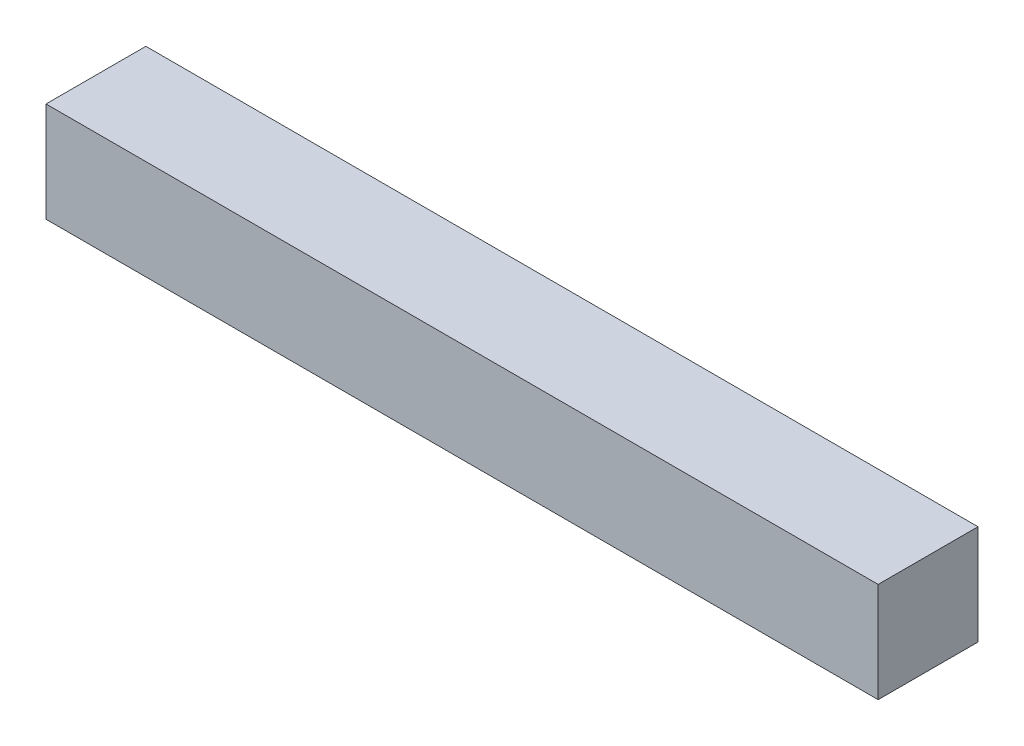
from build123d import *

# Parameters (mm, degrees)
SKETCH1_W           = 38.1
SKETCH1_H           = 38.1
BOSS_EXTRUDE1_DEPTH = 317.5


with BuildPart() as part:
    # Sketch1 → Boss-Extrude1 (new body)
    with BuildSketch(Plane(origin=(0, 0, 0), x_dir=(0, 0, -1), z_dir=(1, 0, 0))):
        with Locations((19.05, -19.05)):
            Rectangle(SKETCH1_W, SKETCH1_H)
    extrude(amount=BOSS_EXTRUDE1_DEPTH)


solid = part.part
